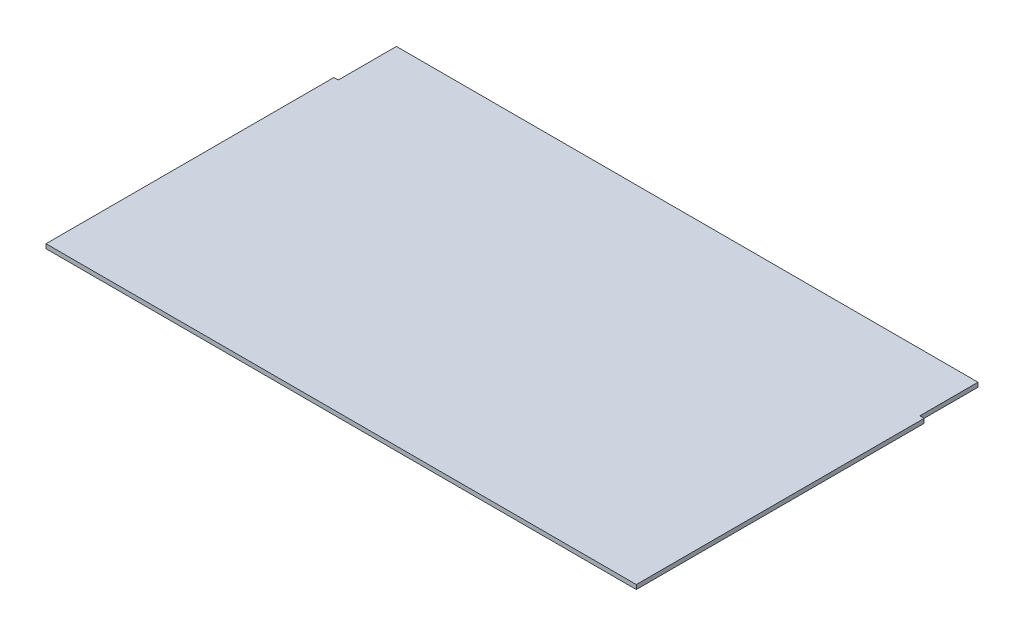
from build123d import *

# Parameters (mm, degrees)
SKETCH1_W           = 406
SKETCH1_H           = 198
BOSS_EXTRUDE1_DEPTH = 3
SKETCH2_W           = 400
SKETCH2_H           = 40
BOSS_EXTRUDE2_DEPTH = 3


with BuildPart() as part:
    # Sketch1 → Boss-Extrude1 (new body)
    with BuildSketch(Plane(origin=(0, 0, 0), x_dir=(1, 0, 0), z_dir=(0, 1, 0))):
        Rectangle(SKETCH1_W, SKETCH1_H)
    extrude(amount=BOSS_EXTRUDE1_DEPTH)

    # Sketch2 → Boss-Extrude2 (add)
    with BuildSketch(Plane(origin=(0, 3, 0), x_dir=(1, 0, 0), z_dir=(0, 1, 0))):
        with Locations((0, 119)):
            Rectangle(SKETCH2_W, SKETCH2_H)
    extrude(amount=-BOSS_EXTRUDE2_DEPTH)


solid = part.part
